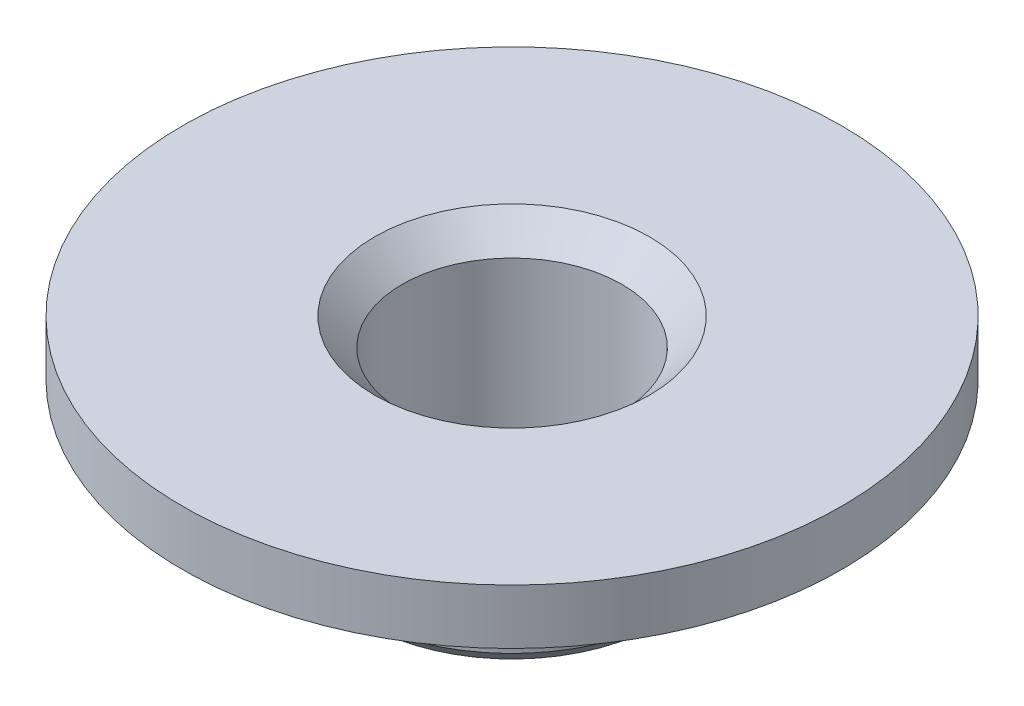
from build123d import *

# Parameters (mm, degrees)
CHANFREIN1_SIZE = 0.5
CHANFREIN2_SIZE = 0.3


with BuildPart() as part:
    # Esquisse1 → Révolution1 (revolve)
    with BuildSketch(Plane.XY, mode=Mode.PRIVATE) as r_volution1_sk:
        Polygon((2, 0), (2, 3.5), (6, 3.5), (6, 2.5), (4.25, 2.5), (4.25, 1.724524585), (3, 1.724524585), (3, 0), align=None)
    revolve(r_volution1_sk.sketch.rotate(Axis((0, 0, 0), (0, 1, 0)), 90), axis=Axis((0, 0, 0), (0, 1, 0)))

    # Chanfrein1
    chanfrein1_edges = [part.edges().sort_by_distance(p)[0] for p in [
        (0, 3.5, 2),
    ]]
    chamfer(chanfrein1_edges, length=CHANFREIN1_SIZE)

    # Chanfrein2
    chanfrein2_edges = [part.edges().sort_by_distance(p)[0] for p in [
        (0, 0, 3),
        (0, 1.724524585, 4.25),
    ]]
    chamfer(chanfrein2_edges, length=CHANFREIN2_SIZE)


solid = part.part
